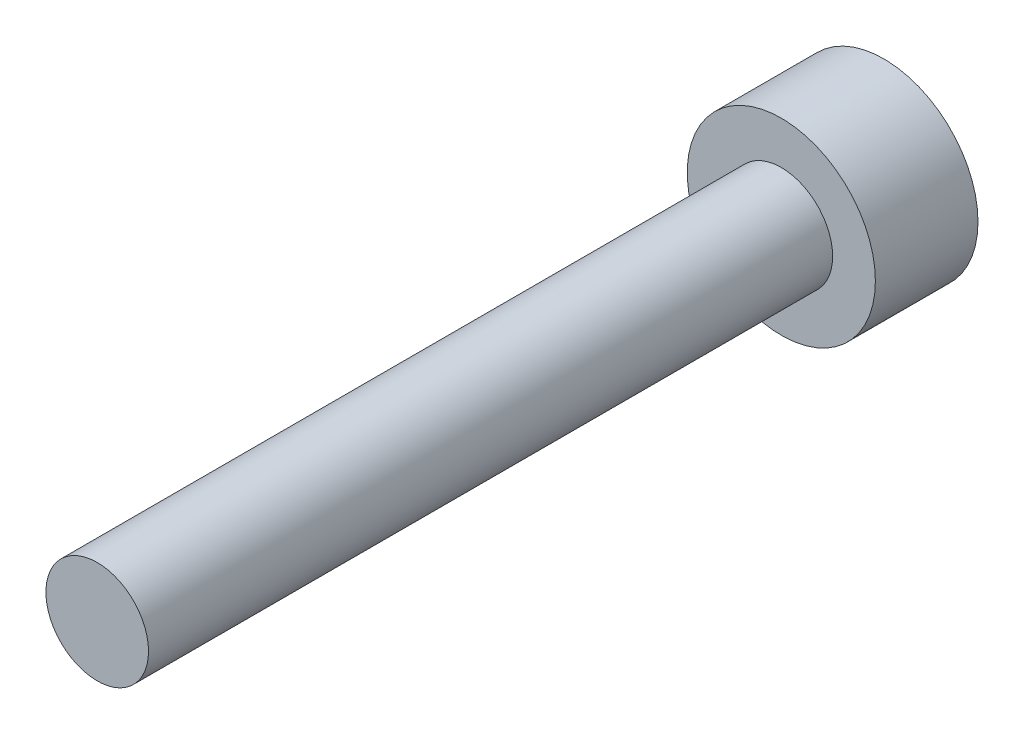
from build123d import *

# Parameters (mm, degrees)
SKETCH_1_R      = 2.75
EXTRUDE_1_DEPTH = 3
SKETCH_2_R      = 1.5
EXTRUDE_2_DEPTH = 20


with BuildPart() as part:
    # 草图1 → 凸台-拉伸1 (new body)
    with BuildSketch(Plane.XY):
        Circle(SKETCH_1_R)
    extrude(amount=EXTRUDE_1_DEPTH)

    # 草图2 → 凸台-拉伸2 (add)
    with BuildSketch(Plane.XY.offset(3)):
        Circle(SKETCH_2_R)
    extrude(amount=EXTRUDE_2_DEPTH)


solid = part.part
